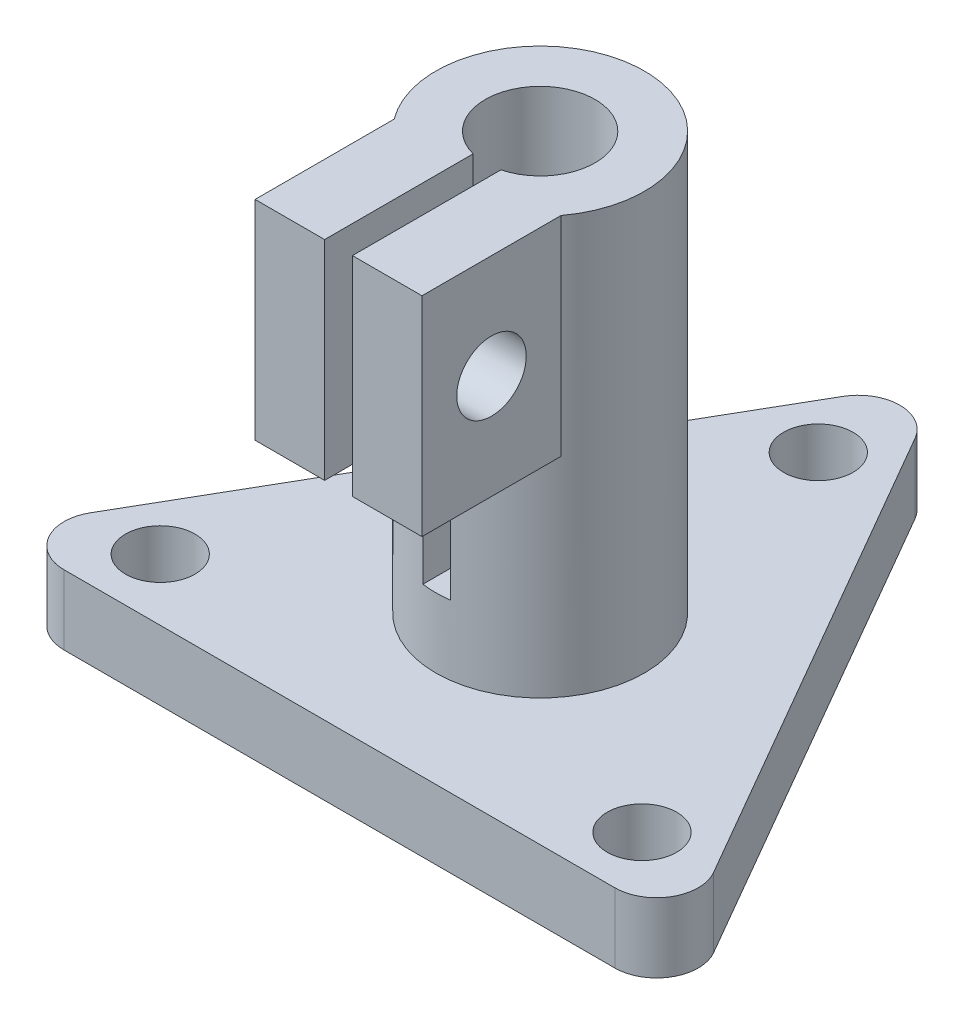
from build123d import *

# Parameters (mm, degrees)
ESQUISSE5_R             = 2.5
BOSS_EXTRU_2_DEPTH      = 5
ESQUISSE6_R             = 7.5
BOSS_EXTRU_3_DEPTH      = 30
BOSS_EXTRU_6_START      = -15
BOSS_EXTRU_6_DEPTH      = 15
ESQUISSE14_R            = 3.95
ENL_V_MAT_EXTRU_4_DEPTH = 52.800900893
ENL_V_MAT_EXTRU_5_DEPTH = 25
CONG_2_R                = 3
ESQUISSE17_R            = 2.5
ENL_V_MAT_EXTRU_6_DEPTH = 53.189940485
ENL_V_MAT_EXTRU_7_DEPTH = 4.5


with BuildPart() as part:
    # Esquisse5 → Boss.-Extru.2 (new body)
    with BuildSketch(Plane(origin=(0, 0, 0), x_dir=(1, 0, 0), z_dir=(0, 1, 0))):
        Polygon((-25, -14.43375673), (25, -14.43375673), (0, 28.867513459), align=None)
        with Locations(Location((0, 20, 0), (0, 0, 270))):
            Circle(ESQUISSE5_R, mode=Mode.SUBTRACT)
        with Locations(Location((-17.320508076, -10, 0), (0, 0, 270))):
            Circle(ESQUISSE5_R, mode=Mode.SUBTRACT)
        with Locations(Location((17.320508076, -10, 0), (0, 0, 270))):
            Circle(ESQUISSE5_R, mode=Mode.SUBTRACT)
    extrude(amount=BOSS_EXTRU_2_DEPTH)

    # Esquisse6 → Boss.-Extru.3 (add)
    with BuildSketch(Plane(origin=(0, 5, 0), x_dir=(1, 0, 0), z_dir=(0, 1, 0))):
        with Locations(Location((0, 0, 0), (0, 0, 270))):
            Circle(ESQUISSE6_R)
    extrude(amount=BOSS_EXTRU_3_DEPTH)

    # Esquisse13 → Boss.-Extru.6 (add)
    with BuildSketch(Plane(origin=(0, 35, 0), x_dir=(1, 0, 0), z_dir=(0, 1, 0)).offset(BOSS_EXTRU_6_START)):
        with BuildLine():
            Line((-6, -4.5), (-6, -14.5))
            Line((-6, -14.5), (6, -14.5))
            Line((6, -14.5), (6, -4.5))
            ThreePointArc((6, -4.5), (0, -7.5), (-6, -4.5))
        make_face()
    extrude(amount=BOSS_EXTRU_6_DEPTH)

    # Esquisse14 → Enlèv. mat.-Extru.4 (cut, through all)
    with BuildSketch(Plane(origin=(0, 35, 0), x_dir=(1, 0, 0), z_dir=(0, 1, 0))):
        with Locations(Location((0, 0, 0), (0, 0, 270))):
            Circle(ESQUISSE14_R)
    extrude(amount=-ENL_V_MAT_EXTRU_4_DEPTH, mode=Mode.SUBTRACT)

    # Esquisse15 → Enlèv. mat.-Extru.5 (cut)
    with BuildSketch(Plane(origin=(0, 35, 0), x_dir=(1, 0, 0), z_dir=(0, 1, 0))):
        with BuildLine():
            Line((-1, -3.821321761), (-1, -14.5))
            Line((-1, -14.5), (1, -14.5))
            Line((1, -14.5), (1, -3.821321761))
            ThreePointArc((1, -3.821321761), (0, -3.95), (-1, -3.821321761))
        make_face()
    extrude(amount=-ENL_V_MAT_EXTRU_5_DEPTH, mode=Mode.SUBTRACT)

    # Congé2
    cong_2_edges = [part.edges().sort_by_distance(p)[0] for p in [
        (0, 2.5, -28.867513459),
        (25, 2.5, 14.43375673),
        (-25, 2.5, 14.43375673),
    ]]
    fillet(cong_2_edges, radius=CONG_2_R)

    # Esquisse17 → Enlèv. mat.-Extru.6 (cut, through all)
    with BuildSketch(Plane(origin=(6, 0, 0), x_dir=(0, 0, -1), z_dir=(1, 0, 0))):
        with Locations(Location((-9.5, 27.5, 0), (0, 0, 180))):
            Circle(ESQUISSE17_R)
    extrude(amount=-ENL_V_MAT_EXTRU_6_DEPTH, mode=Mode.SUBTRACT)

    # Esquisse18 → Enlèv. mat.-Extru.7 (cut)
    with BuildSketch(Plane.ZY.offset(6)):
        Polygon((11.786307066, 31.46), (7.213692934, 31.46), (4.927385868, 27.5), (7.213692934, 23.54), (11.786307066, 23.54), (14.072614132, 27.5), align=None)
    extrude(amount=-ENL_V_MAT_EXTRU_7_DEPTH, mode=Mode.SUBTRACT)


solid = part.part
